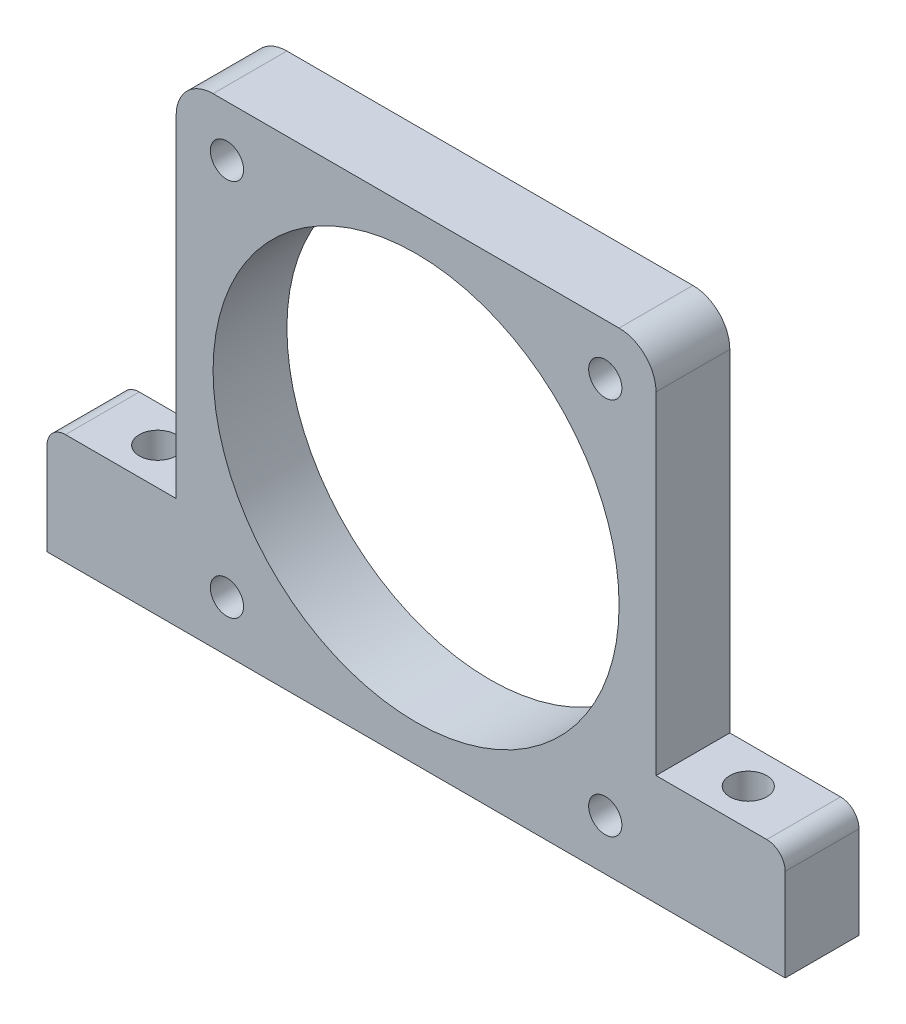
from build123d import *

# Parameters (mm, degrees)
EXTRUDE_1_DEPTH          = 20
SKETCH_2_R               = 4.5
CUT_EXTRUDE_2_DEPTH      = 95.074438611
MIRROR_2_COPY_1_SKETCH_R = 4.5
MIRROR_2_COPY_1_DEPTH    = 95.074438611
SKETCH_3_R               = 55
CUT_EXTRUDE_3_DEPTH      = 95.074438611
EXTRUDE_2_DEPTH          = 20
SKETCH_6_R               = 5
CUT_EXTRUDE_4_DEPTH      = 143.828568571
SKETCH_1312_R            = 2.5
CUT_EXTRUDE_5_DEPTH      = 10


with BuildPart() as part:
    # 草圖1 → 填料-伸長1 (new body)
    with BuildSketch(Plane.XY):
        with BuildLine():
            Line((-55, 65), (55, 65))
            ThreePointArc((55, 65), (62.071067812, 62.071067812), (65, 55))
            Line((65, 55), (65, -65))
            Line((65, -65), (-65, -65))
            Line((-65, -65), (-65, 55))
            ThreePointArc((-65, 55), (-62.071067812, 62.071067812), (-55, 65))
        make_face()
    extrude(amount=EXTRUDE_1_DEPTH)

    # 草圖2 → 除料-伸長2 (cut, through all)
    with BuildSketch(Plane.XY):
        with Locations((51.25, 51.25)):
            Circle(SKETCH_2_R)
    cut_extrude_2 = extrude(amount=CUT_EXTRUDE_2_DEPTH, mode=Mode.SUBTRACT)

    # 鏡射1: 除料-伸長2 across plane
    add(cut_extrude_2.mirror(Plane(origin=(0, 0, 0), x_dir=(0, 0, 1), z_dir=(1, 0, 0))), mode=Mode.SUBTRACT)

    # 鏡射2: 除料-伸長2 across plane
    add(cut_extrude_2.mirror(Plane.ZX), mode=Mode.SUBTRACT)

    # 鏡射2 copy 1 sketch → 鏡射2 copy 1 (cut, through all)
    with BuildSketch(Plane(origin=(0, 0, 0), x_dir=(-1, 0, 0), z_dir=(0, 0, 1))):
        with Locations((51.25, 51.25)):
            Circle(MIRROR_2_COPY_1_SKETCH_R)
    extrude(amount=MIRROR_2_COPY_1_DEPTH, mode=Mode.SUBTRACT)

    # 草圖3 → 除料-伸長3 (cut, through all)
    with BuildSketch(Plane.XY):
        Circle(SKETCH_3_R)
    extrude(amount=CUT_EXTRUDE_3_DEPTH, mode=Mode.SUBTRACT)

    # 草圖5 → 填料-伸長2 (add)
    with BuildSketch(Plane.XY):
        with BuildLine():
            Line((65, -65), (100, -65))
            Line((100, -65), (100, -40))
            ThreePointArc((100, -40), (98.535533906, -36.464466094), (95, -35))
            Line((95, -35), (65, -35))
            Line((65, -35), (65, -65))
        make_face()
    extrude_2 = extrude(amount=EXTRUDE_2_DEPTH)

    # 草圖6 → 除料-伸長4 (cut, through all)
    with BuildSketch(Plane(origin=(0, -35, 0), x_dir=(1, 0, 0), z_dir=(0, 1, 0))):
        with Locations(Location((80, -10, 0), (0, 0, 180))):
            Circle(SKETCH_6_R)
    cut_extrude_4 = extrude(amount=-CUT_EXTRUDE_4_DEPTH, mode=Mode.SUBTRACT)

    # 鏡射3: 填料-伸長2 across plane
    add(extrude_2.mirror(Plane(origin=(0, 0, 0), x_dir=(0, 0, 1), z_dir=(1, 0, 0))))

    # 鏡射4: 除料-伸長4 across plane
    add(cut_extrude_4.mirror(Plane(origin=(0, 0, 0), x_dir=(0, 0, 1), z_dir=(1, 0, 0))), mode=Mode.SUBTRACT)

    # Sketch 1312 → 除料-伸長5 (cut)
    with BuildSketch(Plane(origin=(0, 0, 0), x_dir=(-1, 0, 0), z_dir=(0, 0, -1))):
        with Locations((59.84, -48.46)):
            Circle(SKETCH_1312_R)
        with Locations((-59.84, 48.46)):
            Circle(SKETCH_1312_R)
    extrude(amount=-CUT_EXTRUDE_5_DEPTH, mode=Mode.SUBTRACT)


solid = part.part
